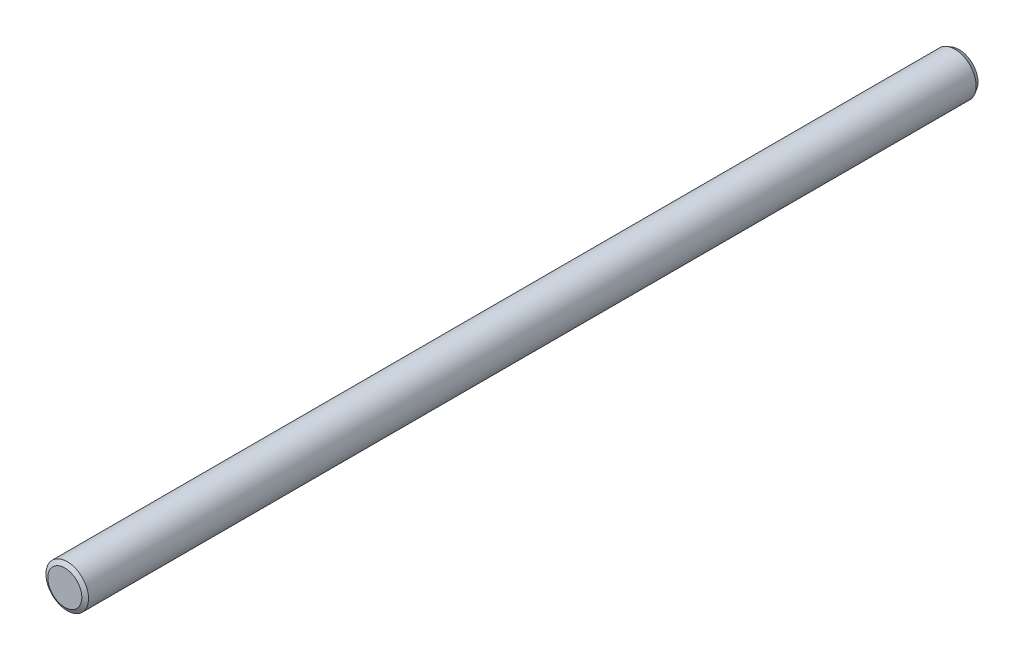
from build123d import *
from OCP.BRepFilletAPI import BRepFilletAPI_MakeChamfer

# Parameters (mm, degrees)
ESBO_O1_R                = 2.5
RESSALTO_EXTRUS_O1_DEPTH = 105
CHANFRO1_SIZE            = 0.5
CHANFRO1_SIZE2           = 0.288675135


with BuildPart() as part:
    # Esboço1 → Ressalto-extrusão1 (new body)
    with BuildSketch(Plane.XY):
        Circle(ESBO_O1_R)
    extrude(amount=RESSALTO_EXTRUS_O1_DEPTH)

    # Chanfro1: one chamfer whose edges measure the first distance from different faces: ONE call of the kernel's chamfer builder (chamfer() names one face for all edges)
    chanfro1_edges_1 = [part.edges().sort_by_distance(p)[0] for p in [
        (-2.5, 0, 0),
    ]]
    chanfro1_side_1 = [part.faces().sort_by_distance(p)[0] for p in [
        (-2.5, 0, 52.5),
    ]]
    chanfro1_edges_2 = [part.edges().sort_by_distance(p)[0] for p in [
        (-2.5, 0, 105),
    ]]
    chanfro1_side_2 = [part.faces().sort_by_distance(p)[0] for p in [
        (0, 0, 105),
    ]]
    chanfro1 = BRepFilletAPI_MakeChamfer(part.part.solid().wrapped)
    for e in chanfro1_edges_1:
        chanfro1.Add(CHANFRO1_SIZE, CHANFRO1_SIZE2, e.wrapped, chanfro1_side_1[0].wrapped)  # the first distance lies on this face
    for e in chanfro1_edges_2:
        chanfro1.Add(CHANFRO1_SIZE, CHANFRO1_SIZE2, e.wrapped, chanfro1_side_2[0].wrapped)  # the first distance lies on this face
    add(Compound.cast(chanfro1.Shape()), mode=Mode.REPLACE)


solid = part.part
